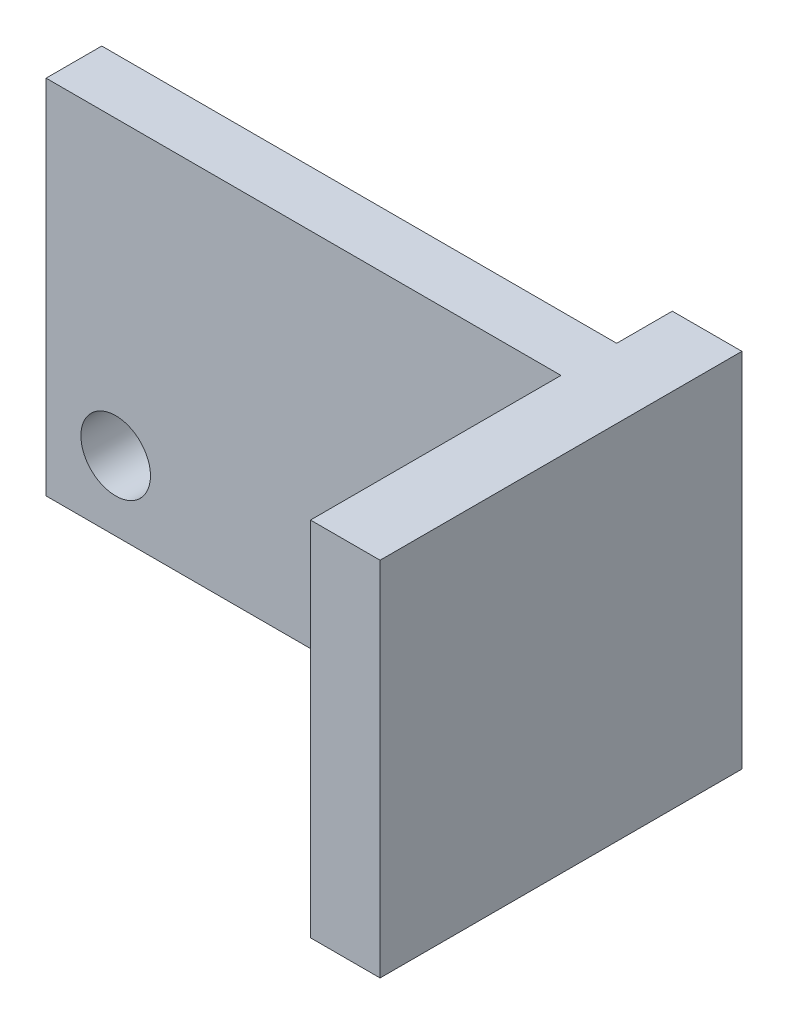
from build123d import *

# Parameters (mm, degrees)
ESQUISSE1_W             = 21
ESQUISSE1_H             = 13
BOSS_EXTRU_1_DEPTH      = 2
ESQUISSE2_R             = 1.25
ENL_V_MAT_EXTRU_1_DEPTH = 2
BOSS_EXTRU_2_DEPTH      = 9
BOSS_EXTRU_2_DEPTH_BACK = 4
ESQUISSE3_W             = 2.5
ESQUISSE3_H             = 13


with BuildPart() as part:
    # Esquisse1 → Boss.-Extru.1 (new body)
    with BuildSketch(Plane.XY):
        with Locations((10.5, 6.5)):
            Rectangle(ESQUISSE1_W, ESQUISSE1_H)
    extrude(amount=BOSS_EXTRU_1_DEPTH)

    # Esquisse2 → Enlèv. mat.-Extru.1 (cut)
    with BuildSketch(Plane.XY.offset(2)):
        with Locations((2.5, 2.5)):
            Circle(ESQUISSE2_R)
    extrude(amount=-ENL_V_MAT_EXTRU_1_DEPTH, mode=Mode.SUBTRACT)

    # Esquisse3 → Boss.-Extru.2 (add, two sides: drawn at the far end of the back side and taken through both)
    with BuildSketch(Plane.XY.offset(2).offset(-BOSS_EXTRU_2_DEPTH_BACK)):
        with Locations((19.75, 6.5)):
            Rectangle(ESQUISSE3_W, ESQUISSE3_H)
    extrude(amount=BOSS_EXTRU_2_DEPTH + BOSS_EXTRU_2_DEPTH_BACK)


solid = part.part
